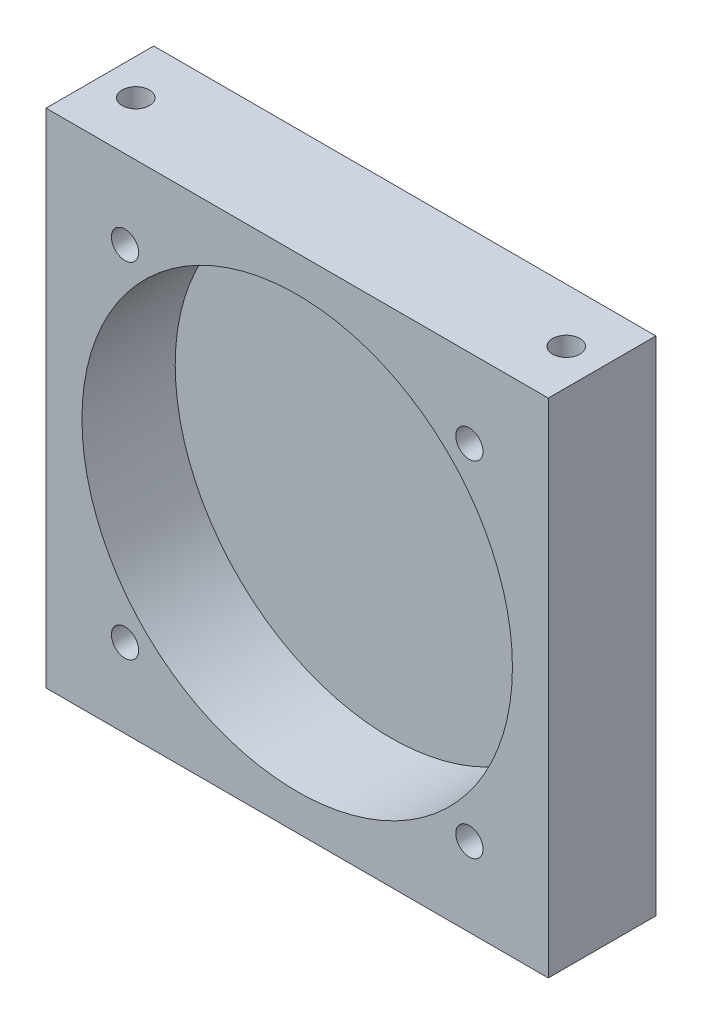
from build123d import *

# Parameters (mm, degrees)
SKETCH1_W                        = 88.9
SKETCH1_H                        = 88.9
BOSS_EXTRUDE1_DEPTH              = 19.05
SKETCH2_R                        = 38.1
CUT_EXTRUDE1_DEPTH               = 16.51
F_10_32_TAPPED_HOLE1_AT_2_COUNT  = 2
F_10_32_TAPPED_HOLE1_AT_2_PITCH  = 76.2
F_10_32_TAPPED_HOLE2_D           = 4.0386
F_10_32_TAPPED_HOLE2_DEPTH       = 14.986
F_10_32_TAPPED_HOLE2_CBORE_D     = 4.826
F_10_32_TAPPED_HOLE2_CBORE_DEPTH = 12.7
F_10_32_TAPPED_HOLE2_TIP         = 1.213317848


with BuildPart() as part:
    # Sketch1 → Boss-Extrude1 (new body)
    with BuildSketch(Plane.XY):
        Rectangle(SKETCH1_W, SKETCH1_H)
    extrude(amount=BOSS_EXTRUDE1_DEPTH)

    # Sketch2 → Cut-Extrude1 (cut)
    with BuildSketch(Plane.XY.offset(19.05)):
        Circle(SKETCH2_R)
    extrude(amount=-CUT_EXTRUDE1_DEPTH, mode=Mode.SUBTRACT)

    # Sketch3 → #10-32 Tapped Hole1 (revolve, cut)
    with BuildSketch(Plane(origin=(-38.1, 44.45, 9.525), x_dir=(0, 0, 1), z_dir=(1, 0, 0))):
        Polygon((0, 0), (0, 22.640757848), (2.0193, 21.42744), (2.0193, 19.05), (2.413, 19.05), (2.413, 0), align=None)
    f_10_32_tapped_hole1 = revolve(axis=Axis((-38.1, 50.8, 9.525), (0, -1, 0)), mode=Mode.SUBTRACT)

    # #10-32 Tapped Hole1 at 2: #10-32 Tapped Hole1 ×2
    with Locations(*[(i * F_10_32_TAPPED_HOLE1_AT_2_PITCH, 0, 0) for i in range(1, F_10_32_TAPPED_HOLE1_AT_2_COUNT)]):
        add(f_10_32_tapped_hole1, mode=Mode.SUBTRACT)

    # Mirror1: #10-32 Tapped Hole1 across plane
    add(f_10_32_tapped_hole1.mirror(Plane.ZX), mode=Mode.SUBTRACT)

    # Mirror1 copy 1 sketch → Mirror1 copy 1 (revolve, cut)
    with BuildSketch(Plane(origin=(38.1, -44.45, 9.525), x_dir=(0, 0, 1), z_dir=(1, 0, 0))):
        Polygon((0, 0), (0, -22.640757848), (2.0193, -21.42744), (2.0193, -19.05), (2.413, -19.05), (2.413, 0), align=None)
    revolve(axis=Axis((38.1, -50.8, 9.525), (0, -1, 0)), mode=Mode.SUBTRACT)

    # #10-32 Tapped Hole2
    with Locations(Plane.XY.offset(19.05)):
        with Locations((30.48, -30.48), (-30.48, -30.48), (-30.48, 30.48), (30.48, 30.48)):
            CounterBoreHole(F_10_32_TAPPED_HOLE2_D / 2, F_10_32_TAPPED_HOLE2_CBORE_D / 2, F_10_32_TAPPED_HOLE2_CBORE_DEPTH, depth=F_10_32_TAPPED_HOLE2_DEPTH)
            with Locations((0, 0, -(F_10_32_TAPPED_HOLE2_DEPTH + F_10_32_TAPPED_HOLE2_TIP / 2))):  # 118° drill point
                Cone(0, F_10_32_TAPPED_HOLE2_D / 2, F_10_32_TAPPED_HOLE2_TIP, mode=Mode.SUBTRACT)


solid = part.part
